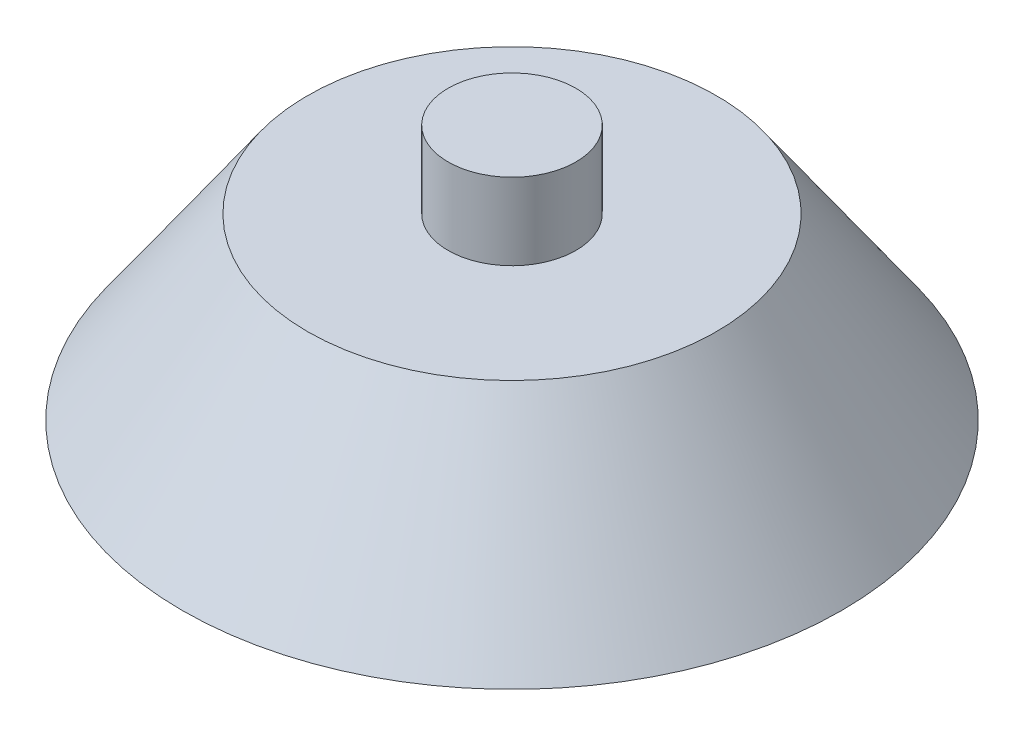
from build123d import *

# Parameters (mm, degrees)
SKETCH1_R           = 25
BOSS_EXTRUDE1_DEPTH = 100
SKETCH2_R           = 80
BOSS_EXTRUDE2_DEPTH = 70
DRAFT1_ANGLE        = 35
SKETCH4_W           = 50
SKETCH4_H           = 50
CUT_EXTRUDE1_DEPTH  = 50


with BuildPart() as part:
    # Sketch1 → Boss-Extrude1 (new body)
    with BuildSketch(Plane(origin=(0, 0, 0), x_dir=(1, 0, 0), z_dir=(0, 1, 0))):
        with Locations(Location((0, 0, 0), (0, 0, 90))):
            Circle(SKETCH1_R)
    extrude(amount=BOSS_EXTRUDE1_DEPTH)

    # Sketch2 → Boss-Extrude2 (add)
    with BuildSketch(Plane(origin=(0, 0, 0), x_dir=(1, 0, 0), z_dir=(0, 1, 0))):
        with Locations(Location((0, 0, 0), (0, 0, 270))):
            Circle(SKETCH2_R)
    extrude(amount=BOSS_EXTRUDE2_DEPTH)

    # Draft1
    draft1_faces = [part.faces().sort_by_distance(p)[0] for p in [
        (0, 35, -80),
    ]]
    draft(draft1_faces, Plane.ZX.offset(70), DRAFT1_ANGLE)

    # Sketch4 → Cut-Extrude1 (cut)
    with BuildSketch(Plane.XZ):
        Rectangle(SKETCH4_W, SKETCH4_H)
    extrude(amount=-CUT_EXTRUDE1_DEPTH, mode=Mode.SUBTRACT)


solid = part.part
